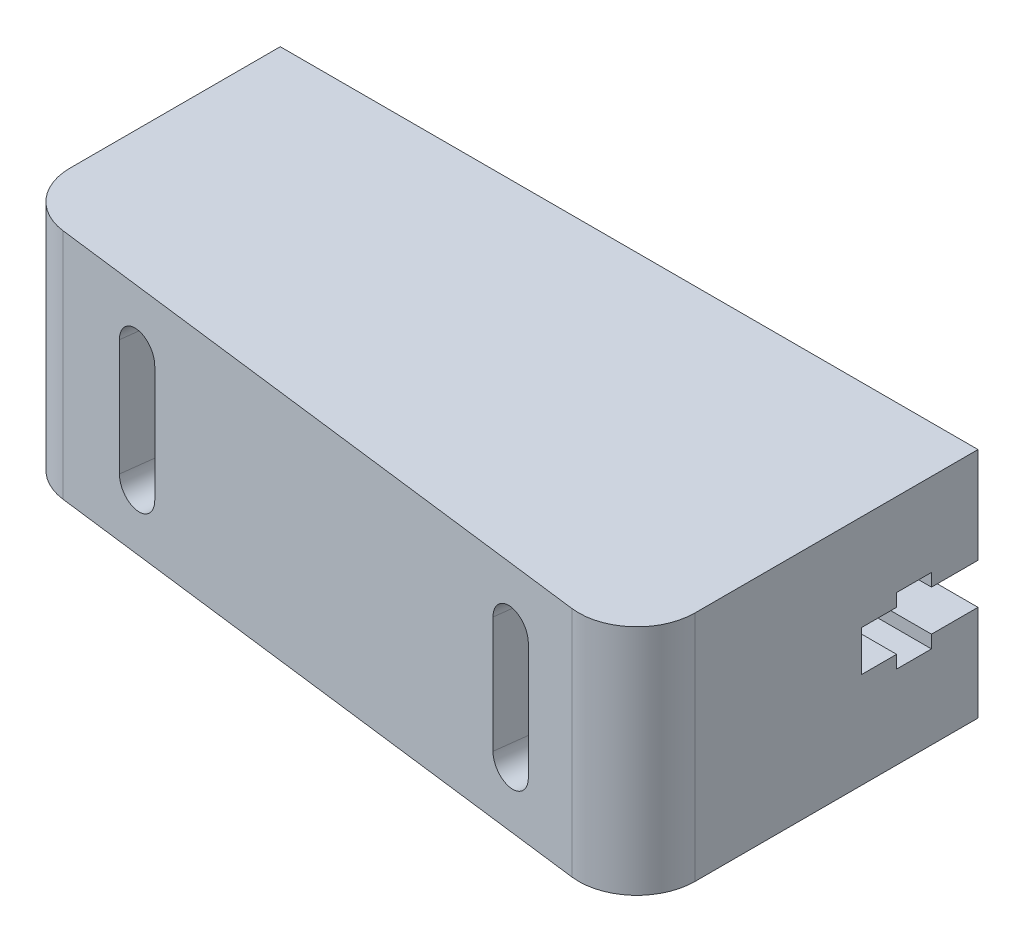
from build123d import *

# Parameters (mm, degrees)
SKETCH1_W               = 60
SKETCH1_H               = 20
BOSS_EXTRUDE1_DEPTH     = 30
CUT_EXTRUDE1_DEPTH      = 47.904157598
CUT_EXTRUDE2_START      = -4
CUT_EXTRUDE2_DEPTH      = 43.904157598
CUT_EXTRUDE3_DEPTH      = 68.823299831
CUT_EXTRUDE3_DEPTH_BACK = 68.823299831
SKETCH5_R               = 1.75
CUT_EXTRUDE4_DEPTH      = 44.27017093
CUT_EXTRUDE5_DEPTH      = 5
FILLET1_R               = 5


with BuildPart() as part:
    # Sketch1 → Boss-Extrude1 (new body)
    with BuildSketch(Plane.XY):
        Rectangle(SKETCH1_W, SKETCH1_H)
    extrude(amount=BOSS_EXTRUDE1_DEPTH)

    # Sketch2 → Cut-Extrude1 (cut, through all)
    with BuildSketch(Plane(origin=(0, 10, 0), x_dir=(1, 0, 0), z_dir=(0, 1, 0))):
        Polygon((-30, -30), (30, -30), (-30, -22.5), align=None)
    extrude(amount=-CUT_EXTRUDE1_DEPTH, mode=Mode.SUBTRACT)

    # Sketch3 → Cut-Extrude2 (cut, through all)
    with BuildSketch(Plane(origin=(0, 10, 0), x_dir=(1, 0, 0), z_dir=(0, 1, 0)).offset(CUT_EXTRUDE2_START)):
        Polygon((-25, 0), (25, 0), (25, -24.336088907), (-25, -18.086088907), align=None)
    extrude(amount=-CUT_EXTRUDE2_DEPTH, mode=Mode.SUBTRACT)

    # Sketch4 → Cut-Extrude3 (cut, two sides: drawn at the far end of the back side and taken through both)
    with BuildSketch(Plane.ZY.offset(30).offset(-CUT_EXTRUDE3_DEPTH_BACK)):
        Polygon((4, 1.75), (0, 1.75), (0, -1.75), (4, -1.75), (4, -2.85), (7, -2.85), (7, -1.75), (10, -1.75), (10, 1.75), (7, 1.75), (7, 2.85), (4, 2.85), align=None)
    extrude(amount=CUT_EXTRUDE3_DEPTH + CUT_EXTRUDE3_DEPTH_BACK, mode=Mode.SUBTRACT)

    # Sketch5 → Cut-Extrude4 (cut, through all)
    with BuildSketch(Plane(origin=(-3.230769231, 0, 25.846153846), x_dir=(0.9922778767136677, 0, 0.12403473458920845), z_dir=(-0.12403473458920845, 0, 0.9922778767136677))):
        with Locations((21.755911783, 0)):
            Circle(SKETCH5_R)
        with Locations((-15.244088217, 0)):
            Circle(SKETCH5_R)
    extrude(amount=-CUT_EXTRUDE4_DEPTH, mode=Mode.SUBTRACT)

    # Sketch6 → Cut-Extrude5 (cut)
    with BuildSketch(Plane(origin=(-3.230769231, 0, 25.846153846), x_dir=(0.9922778767136677, 0, 0.12403473458920845), z_dir=(-0.12403473458920845, 0, 0.9922778767136677))):
        with BuildLine():
            Line((-13.494088217, 5), (-13.494088217, -5))
            ThreePointArc((-13.494088217, -5), (-15.244088217, -6.75), (-16.994088217, -5))
            Line((-16.994088217, -5), (-16.994088217, 5))
            ThreePointArc((-16.994088217, 5), (-15.244088217, 6.75), (-13.494088217, 5))
        make_face()
        with BuildLine():
            Line((20.005911783, 5), (20.005911783, -5))
            ThreePointArc((20.005911783, -5), (21.755911783, -6.75), (23.505911783, -5))
            Line((23.505911783, -5), (23.505911783, 5))
            ThreePointArc((23.505911783, 5), (21.755911783, 6.75), (20.005911783, 5))
        make_face()
    extrude(amount=-CUT_EXTRUDE5_DEPTH, mode=Mode.SUBTRACT)

    # Fillet1
    fillet1_edges = [part.edges().sort_by_distance(p)[0] for p in [
        (-30, 0, 22.5),
        (30, 0, 30),
    ]]
    fillet(fillet1_edges, radius=FILLET1_R)


solid = part.part
